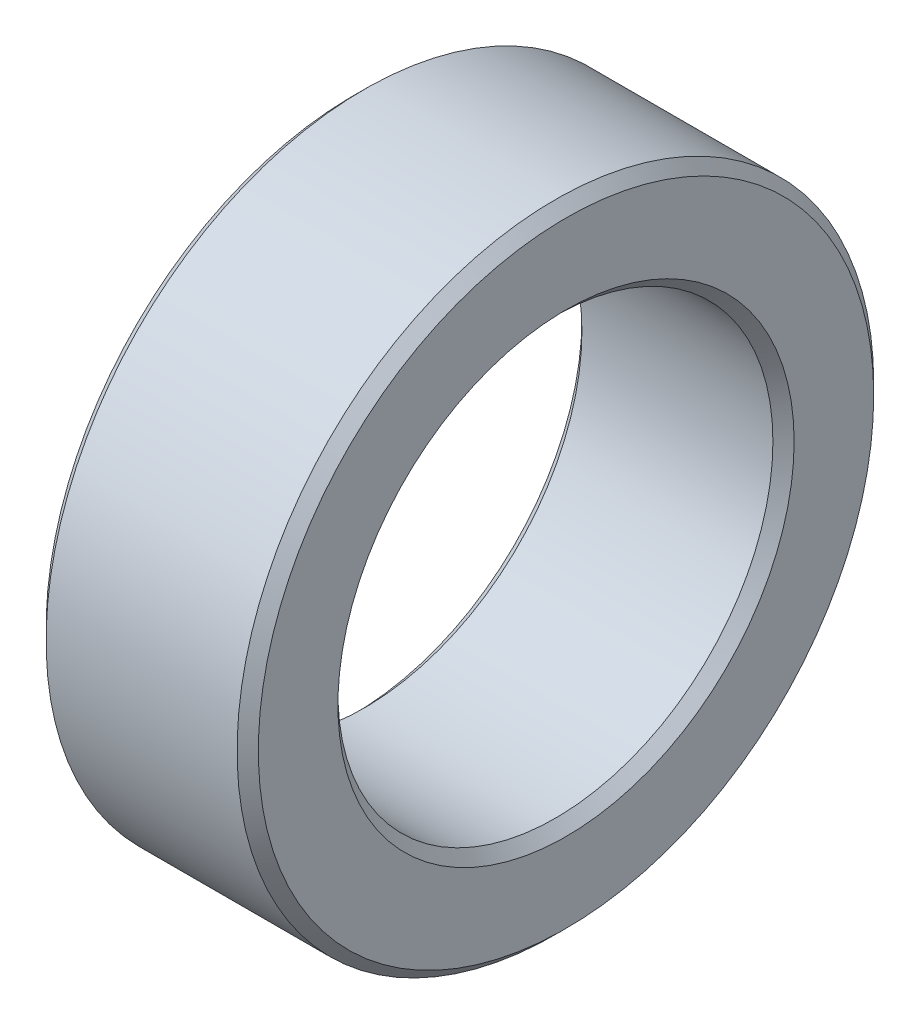
from build123d import *

# Parameters (mm, degrees)
SKETCH_1_R      = 3
SKETCH_1_R_2    = 2.05
EXTRUDE_1_DEPTH = 2
CHAMFER_1_SIZE  = 0.1


with BuildPart() as part:
    # 草图1 → 凸台-拉伸1 (new body)
    with BuildSketch(Plane.YZ):
        with Locations(Location((0, 0, 0), (0, 0, 270))):
            Circle(SKETCH_1_R)
        with Locations(Location((0, 0, 0), (0, 0, 270))):
            Circle(SKETCH_1_R_2, mode=Mode.SUBTRACT)
    extrude(amount=EXTRUDE_1_DEPTH)

    # 倒角1
    chamfer_1_edges = [part.edges().sort_by_distance(p)[0] for p in [
        (0, 0, 3),
        (2, 0, 3),
        (0, 0, 2.05),
        (2, 0, 2.05),
    ]]
    chamfer(chamfer_1_edges, length=CHAMFER_1_SIZE)


solid = part.part
